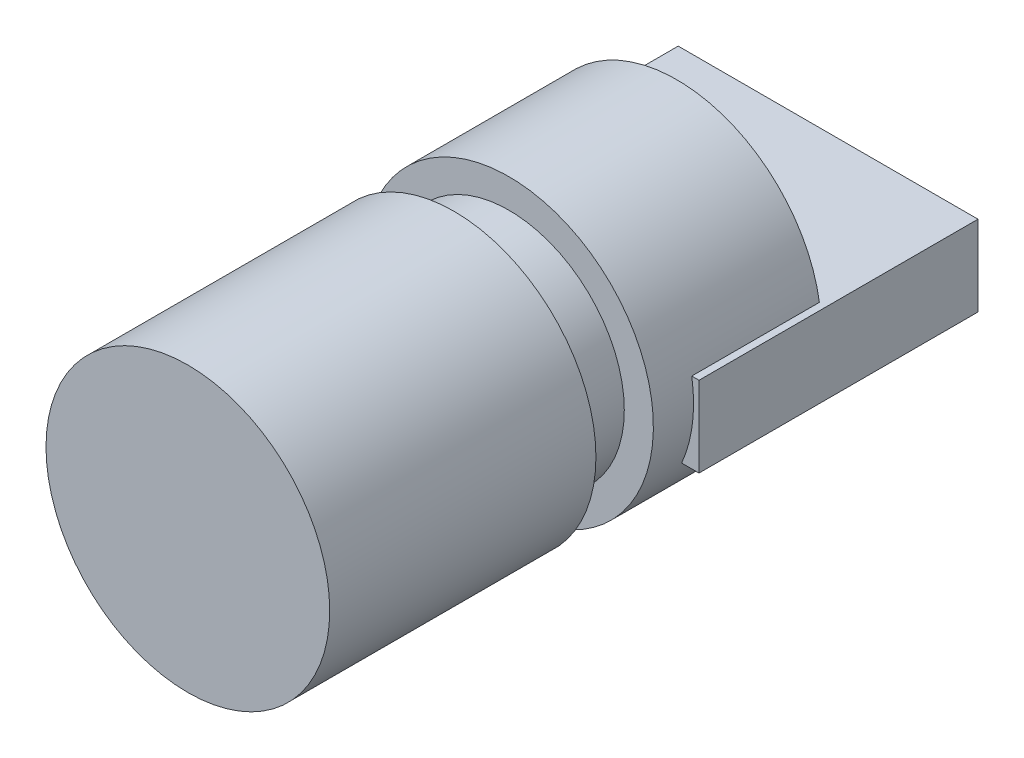
from build123d import *

# Parameters (mm, degrees)
SKETCH3_R           = 3
BOSS_EXTRUDE1_DEPTH = 5.63
SKETCH8_R           = 2.44
BOSS_EXTRUDE2_DEPTH = 1.16
SKETCH9_R           = 3.055
BOSS_EXTRUDE3_DEPTH = 3.55
BOSS_EXTRUDE4_START = 0.485
SKETCH15_W          = 6.34
SKETCH15_H          = 5.9
BOSS_EXTRUDE4_DEPTH = 1.7


with BuildPart() as part:
    # Sketch3 → Boss-Extrude1 (new body)
    with BuildSketch(Plane.XY):
        with Locations((-7.67170946, 4.798899109)):
            Circle(SKETCH3_R)
    extrude(amount=BOSS_EXTRUDE1_DEPTH)

    # Sketch8 → Boss-Extrude2 (add)
    with BuildSketch(Plane(origin=(0, 0, 0), x_dir=(-1, 0, 0), z_dir=(0, 0, -1))):
        with Locations(Location((7.67170946, 4.798899109, 0), (0, 0, 180))):
            Circle(SKETCH8_R)
    extrude(amount=BOSS_EXTRUDE2_DEPTH)

    # Sketch9 → Boss-Extrude3 (add)
    with BuildSketch(Plane(origin=(0, 0, -1.16), x_dir=(-1, 0, 0), z_dir=(0, 0, -1))):
        with Locations((7.67170946, 4.798899109)):
            Circle(SKETCH9_R)
    extrude(amount=BOSS_EXTRUDE3_DEPTH)

    # Sketch15 → Boss-Extrude4 (add)
    with BuildSketch(Plane(origin=(0, 4.798899109, 0), x_dir=(1, 0, 0), z_dir=(0, 1, 0)).offset(BOSS_EXTRUDE4_START)):
        with Locations((-7.67170946, 4.96)):
            Rectangle(SKETCH15_W, SKETCH15_H)
    extrude(amount=-BOSS_EXTRUDE4_DEPTH)


solid = part.part
